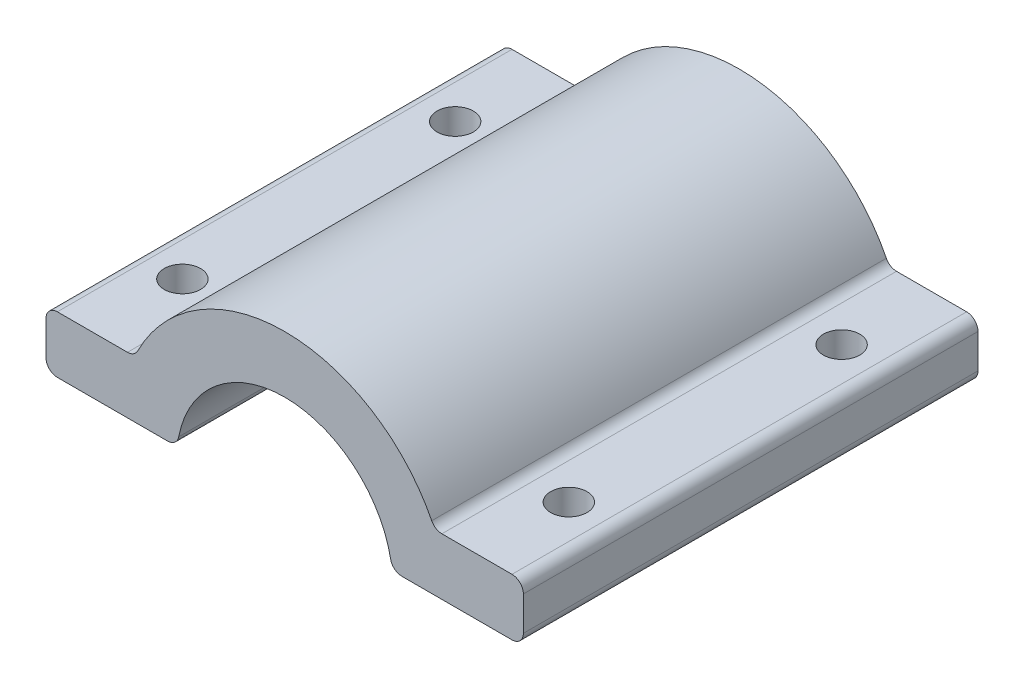
from build123d import *

# Parameters (mm, degrees)
EXTRUDE_1_DEPTH     = 40
SKETCH_2_R          = 1.6
CUT_EXTRUDE_1_DEPTH = 40


with BuildPart() as part:
    # 草图1 → 凸台-拉伸1 (new body)
    with BuildSketch(Plane.XY):
        with BuildLine():
            Line((-14.465476141, 1), (-10.307764064, 1))
            ThreePointArc((-10.307764064, 1), (-9.671555054, 1.22848325), (-9.326072248, 1.80952381))
            ThreePointArc((-9.326072248, 1.80952381), (0, 9.5), (9.326072248, 1.80952381))
            ThreePointArc((9.326072248, 1.80952381), (9.671555054, 1.22848325), (10.307764064, 1))
            Line((10.307764064, 1), (14.465476141, 1))
            Line((14.465476141, 1), (20, 1))
            ThreePointArc((20, 1), (20.707106781, 1.292893219), (21, 2))
            Line((21, 2), (21, 5))
            ThreePointArc((21, 5), (20.707106781, 5.707106781), (20, 6))
            Line((20, 6), (13.829316686, 6))
            ThreePointArc((13.829316686, 6), (13.305681748, 6.148057249), (12.937102706, 6.548387097))
            ThreePointArc((12.937102706, 6.548387097), (0, 14.5), (-12.937102706, 6.548387097))
            ThreePointArc((-12.937102706, 6.548387097), (-13.305681748, 6.148057249), (-13.829316686, 6))
            Line((-13.829316686, 6), (-20, 6))
            ThreePointArc((-20, 6), (-20.707106781, 5.707106781), (-21, 5))
            Line((-21, 5), (-21, 2))
            ThreePointArc((-21, 2), (-20.707106781, 1.292893219), (-20, 1))
            Line((-20, 1), (-14.465476141, 1))
        make_face()
    extrude(amount=EXTRUDE_1_DEPTH)

    # 草图2 → 切除-拉伸1 (cut)
    with BuildSketch(Plane(origin=(0, 6, 0), x_dir=(1, 0, 0), z_dir=(0, 1, 0))):
        with Locations(Location((-17, -8, 0), (0, 0, 270))):
            Circle(SKETCH_2_R)
        with Locations(Location((17, -8, 0), (0, 0, 270))):
            Circle(SKETCH_2_R)
        with Locations(Location((17, -32, 0), (0, 0, 270))):
            Circle(SKETCH_2_R)
        with Locations(Location((-17, -32, 0), (0, 0, 270))):
            Circle(SKETCH_2_R)
    extrude(amount=-CUT_EXTRUDE_1_DEPTH, mode=Mode.SUBTRACT)


solid = part.part
